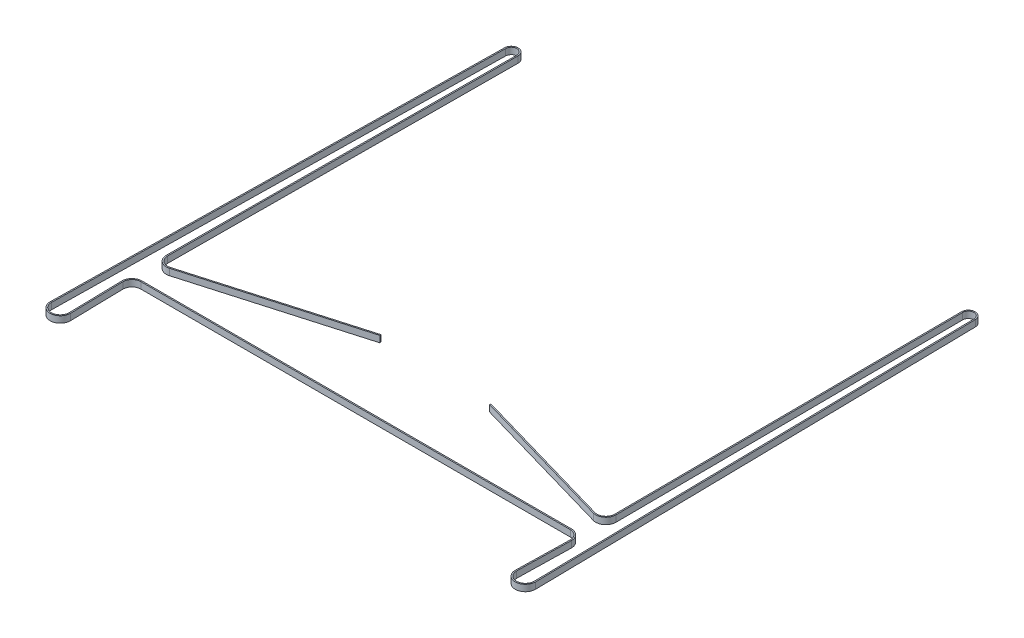
from build123d import *

# Parameters (mm, degrees)
EXTRUDE_THIN1_START = 98.137598
EXTRUDE_THIN1_DEPTH = 6.35


with BuildPart() as part:
    # Sketch1 → Extrude-Thin1 (new body)
    with BuildSketch(Plane(origin=(0, 0, 0), x_dir=(1, 0, 0), z_dir=(0, 1, 0)).offset(EXTRUDE_THIN1_START)):
        with BuildLine():
            Line((311.384156583, -393.071196862), (454.971450984, -434.4441807))
            ThreePointArc((454.971450984, -434.4441807), (463.731585213, -432.81661092), (467.676188529, -424.827303078))
            Line((467.676188529, -424.827303078), (465.748831099, -81.524595581))
            ThreePointArc((465.748831099, -81.524595581), (471.250148893, -75.931455396), (476.872500072, -81.402916061))
            Line((476.872500072, -81.402916061), (484.031755857, -521.592061355))
            ThreePointArc((484.031755857, -521.592061355), (475.259385627, -530.484320798), (466.534962634, -521.545014287))
            Line((466.534962634, -521.545014287), (467.673997369, -468.918565217))
            ThreePointArc((467.673997369, -468.918565217), (464.83775402, -461.744085815), (457.726327103, -458.753260135))
            Line((457.726327103, -458.753260135), (217.954761626, -458.753260135))
            Line((217.954761626, -458.753260135), (34.733672902, -458.753260135))
            ThreePointArc((34.733672902, -458.753260135), (27.622245985, -461.744085815), (24.786002636, -468.918565217))
            Line((24.786002636, -468.918565217), (25.925037371, -521.545014287))
            ThreePointArc((25.925037371, -521.545014287), (17.200614378, -530.484320798), (8.428244148, -521.592061355))
            Line((8.428244148, -521.592061355), (15.587499933, -81.402916061))
            ThreePointArc((15.587499933, -81.402916061), (21.209851112, -75.931455396), (26.711168906, -81.524595581))
            Line((26.711168906, -81.524595581), (24.783811476, -424.827303078))
            ThreePointArc((24.783811476, -424.827303078), (28.728414792, -432.81661092), (37.488549021, -434.4441807))
            Line((37.488549021, -434.4441807), (198.456355388, -388.063207515))
            Line((198.456355388, -388.063207515), (198.124106824, -386.910119968))
            Line((198.124106824, -386.910119968), (37.156300457, -433.291093153))
            ThreePointArc((37.156300457, -433.291093153), (29.452664828, -431.859813195), (25.983792565, -424.834039968))
            Line((25.983792565, -424.834039968), (27.911149995, -81.53133247))
            ThreePointArc((27.911149995, -81.53133247), (21.222976879, -74.731527184), (14.387658613, -81.383401789))
            Line((14.387658613, -81.383401789), (7.228402828, -521.572547083))
            ThreePointArc((7.228402828, -521.572547083), (17.203841042, -531.68431646), (27.124756398, -521.519047845))
            Line((27.124756398, -521.519047845), (25.985721663, -468.892598775))
            ThreePointArc((25.985721663, -468.892598775), (28.479905513, -462.58338322), (34.733672902, -459.953260135))
            Line((34.733672902, -459.953260135), (217.954761626, -459.953260135))
            Line((217.954761626, -459.953260135), (457.726327103, -459.953260135))
            ThreePointArc((457.726327103, -459.953260135), (463.980094492, -462.58338322), (466.474278342, -468.892598775))
            Line((466.474278342, -468.892598775), (465.335243607, -521.519047845))
            ThreePointArc((465.335243607, -521.519047845), (475.256158963, -531.68431646), (485.231597177, -521.572547083))
            Line((485.231597177, -521.572547083), (478.072341392, -81.383401789))
            ThreePointArc((478.072341392, -81.383401789), (471.237023126, -74.731527184), (464.54885001, -81.53133247))
            Line((464.54885001, -81.53133247), (466.47620744, -424.834039968))
            ThreePointArc((466.47620744, -424.834039968), (463.007335177, -431.859813195), (455.303699548, -433.291093153))
            Line((455.303699548, -433.291093153), (311.716405148, -391.918109315))
            Line((311.716405148, -391.918109315), (311.384156583, -393.071196862))
        make_face()
    extrude(amount=EXTRUDE_THIN1_DEPTH)


solid = part.part
